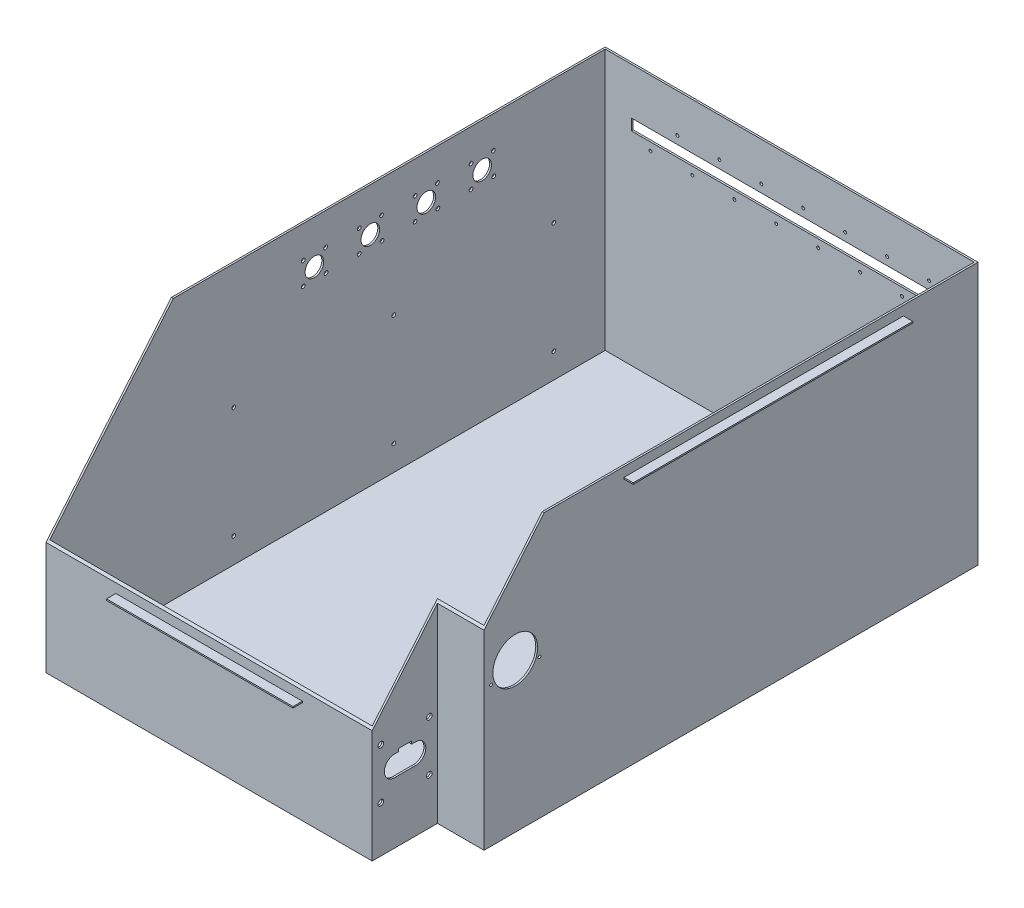
from build123d import *

# Parameters (mm, degrees)
BOSS_EXTRUDE1_DEPTH     = 1.5
BOSS_EXTRUDE2_DEPTH     = 280
SKETCH4_W               = 400
SKETCH4_H               = 42.385541564
BOSS_EXTRUDE3_DEPTH     = 2
CUT_EXTRUDE1_DEPTH      = 609.61485268
CUT_EXTRUDE1_DEPTH_BACK = 609.61485268
SKETCH10_R              = 3
CUT_EXTRUDE2_DEPTH      = 2
SKETCH5_R               = 2
SKETCH5_R_2             = 10
CUT_EXTRUDE7_DEPTH      = 2
SKETCH21_W              = 300
SKETCH21_H              = 1.5
BOSS_EXTRUDE9_DEPTH     = 10
SKETCH22_W              = 300
SKETCH22_H              = 1.5
BOSS_EXTRUDE10_DEPTH    = 10
BOSS_EXTRUDE11_DEPTH    = 0.75
BOSS_EXTRUDE12_DEPTH    = 0.75
BOSS_EXTRUDE13_DEPTH    = 0.75
BOSS_EXTRUDE14_DEPTH    = 0.75
SKETCH27_W              = 200
SKETCH27_H              = 1.5
BOSS_EXTRUDE15_DEPTH    = 10
BOSS_EXTRUDE16_DEPTH    = 0.75
BOSS_EXTRUDE17_DEPTH    = 0.75
SKETCH30_R              = 24
SKETCH30_R_2            = 1.5
CUT_EXTRUDE8_DEPTH      = 2
SKETCH33_R              = 2
CUT_EXTRUDE9_DEPTH      = 2
SKETCH42_W              = 340
SKETCH42_H              = 12
SKETCH42_R              = 1.6
CUT_EXTRUDE13_DEPTH     = 40


with BuildPart() as part:
    # Sketch1 → Boss-Extrude1 (new body)
    with BuildSketch(Plane(origin=(0, 0, 0), x_dir=(1, 0, 0), z_dir=(0, 1, 0))):
        Polygon((-200, 237.826300096), (200, 237.826300096), (200, -292.173699904), (150, -292.173699904), (150, -362.173699904), (-200, -362.173699904), align=None)
    extrude(amount=BOSS_EXTRUDE1_DEPTH)

    # Sketch2 → Boss-Extrude2 (add)
    with BuildSketch(Plane(origin=(0, 1.5, 0), x_dir=(1, 0, 0), z_dir=(0, 1, 0))):
        Polygon((-200, 237.826300096), (-200, -362.173699904), (150, -362.173699904), (150, -292.173699904), (200, -292.173699904), (200, 237.826300096), align=None)
        Polygon((-198, 235.826300096), (-198, -360.173699904), (148, -360.173699904), (148, -290.173699904), (198, -290.173699904), (198, 235.826300096), align=None, mode=Mode.SUBTRACT)
    extrude(amount=BOSS_EXTRUDE2_DEPTH)

    # Sketch4 → Boss-Extrude3 (add)
    with BuildSketch(Plane(origin=(0, 0, -237.826300096), x_dir=(-1, 0, 0), z_dir=(0, 0, -1))):
        with Locations((0, 213.483316708)):
            Rectangle(SKETCH4_W, SKETCH4_H)
    extrude(amount=-BOSS_EXTRUDE3_DEPTH)

    # Sketch3 → Cut-Extrude1 (cut, two sides: drawn at the far end of the back side and taken through both)
    with BuildSketch(Plane.ZY.offset(200).offset(-CUT_EXTRUDE1_DEPTH_BACK)):
        Polygon((362.173699904, 121.117558148), (227.596852099, 281.5), (362.173699904, 281.5), align=None)
    extrude(amount=CUT_EXTRUDE1_DEPTH + CUT_EXTRUDE1_DEPTH_BACK, mode=Mode.SUBTRACT)

    # Sketch10 → Cut-Extrude2 (cut)
    with BuildSketch(Plane.ZY.offset(-148)):
        with BuildLine():
            Line((333.923699904, 90.5), (319.923699904, 90.5))
            Line((319.923699904, 90.5), (319.923699904, 87.5))
            Line((319.923699904, 87.5), (315.673699904, 87.5))
            ThreePointArc((315.673699904, 87.5), (304.673699904, 76.5), (315.673699904, 65.5))
            Line((315.673699904, 65.5), (338.173699904, 65.5))
            ThreePointArc((338.173699904, 65.5), (349.173699904, 76.5), (338.173699904, 87.5))
            Line((338.173699904, 87.5), (333.923699904, 87.5))
            Line((333.923699904, 87.5), (333.923699904, 90.5))
        make_face()
        with Locations((300.973699904, 103.45)):
            Circle(SKETCH10_R)
        with Locations((352.873699904, 103.45)):
            Circle(SKETCH10_R)
        with Locations((300.973699904, 49.55)):
            Circle(SKETCH10_R)
        with Locations((352.873699904, 49.55)):
            Circle(SKETCH10_R)
    extrude(amount=-CUT_EXTRUDE2_DEPTH, mode=Mode.SUBTRACT)

    # Sketch5 → Cut-Extrude7 (cut)
    with BuildSketch(Plane.ZY.offset(200)):
        with Locations((-115.826300096, 247.120648807)):
            Circle(SKETCH5_R)
        with Locations((-116.326300096, 223.125857706)):
            Circle(SKETCH5_R)
        with Locations((-91.826300096, 223.120648807)):
            Circle(SKETCH5_R)
        with Locations((-91.826300096, 247.120648807)):
            Circle(SKETCH5_R)
        with Locations((-103.826300096, 235.120648807)):
            Circle(SKETCH5_R_2)
        with Locations((-55.826300096, 247.120648807)):
            Circle(SKETCH5_R)
        with Locations((-56.326300096, 223.125857706)):
            Circle(SKETCH5_R)
        with Locations((-31.826300096, 223.120648807)):
            Circle(SKETCH5_R)
        with Locations((-31.826300096, 247.120648807)):
            Circle(SKETCH5_R)
        with Locations((-43.826300096, 235.120648807)):
            Circle(SKETCH5_R_2)
        with Locations((4.173699904, 247.120648807)):
            Circle(SKETCH5_R)
        with Locations((3.673699904, 223.125857706)):
            Circle(SKETCH5_R)
        with Locations((28.173699904, 223.120648807)):
            Circle(SKETCH5_R)
        with Locations((28.173699904, 247.120648807)):
            Circle(SKETCH5_R)
        with Locations((16.173699904, 235.120648807)):
            Circle(SKETCH5_R_2)
        with Locations((64.173699904, 247.120648807)):
            Circle(SKETCH5_R)
        with Locations((63.673699904, 223.125857706)):
            Circle(SKETCH5_R)
        with Locations((88.173699904, 223.120648807)):
            Circle(SKETCH5_R)
        with Locations((88.173699904, 247.120648807)):
            Circle(SKETCH5_R)
        with Locations((76.173699904, 235.120648807)):
            Circle(SKETCH5_R_2)
    extrude(amount=-CUT_EXTRUDE7_DEPTH, mode=Mode.SUBTRACT)

    # Sketch21 → Boss-Extrude9 (add)
    with BuildSketch(Plane(origin=(0, 0, -237.826300096), x_dir=(-1, 0, 0), z_dir=(0, 0, -1))):
        with Locations((0, 270.75)):
            Rectangle(SKETCH21_W, SKETCH21_H)
    extrude(amount=BOSS_EXTRUDE9_DEPTH)

    # Sketch22 → Boss-Extrude10 (add)
    with BuildSketch(Plane.ZY.offset(200)):
        with Locations((-7.826300096, 270.75)):
            Rectangle(SKETCH22_W, SKETCH22_H)
    boss_extrude10 = extrude(amount=BOSS_EXTRUDE10_DEPTH)

    # Sketch23 → Boss-Extrude11 (add, symmetric)
    with BuildSketch(Plane(origin=(0, 0, -77.826300096), x_dir=(-1, 0, 0), z_dir=(0, 0, -1))):
        Polygon((210, 270), (200, 270), (200, 260), align=None)
    boss_extrude11 = extrude(amount=BOSS_EXTRUDE11_DEPTH, both=True)

    # Sketch24 → Boss-Extrude12 (add, symmetric)
    with BuildSketch(Plane.XY.offset(52.173699904)):
        Polygon((-210, 270), (-200, 260), (-200, 270), align=None)
    boss_extrude12 = extrude(amount=BOSS_EXTRUDE12_DEPTH, both=True)

    # Sketch25 → Boss-Extrude13 (add, symmetric)
    with BuildSketch(Plane(origin=(100, 0, 0), x_dir=(0, 0, -1), z_dir=(1, 0, 0))):
        Polygon((247.826300096, 270), (237.826300096, 270), (237.826300096, 260), align=None)
    extrude(amount=BOSS_EXTRUDE13_DEPTH, both=True)

    # Sketch26 → Boss-Extrude14 (add, symmetric)
    with BuildSketch(Plane.ZY.offset(100)):
        Polygon((-247.826300096, 270), (-237.826300096, 260), (-237.826300096, 270), align=None)
    extrude(amount=BOSS_EXTRUDE14_DEPTH, both=True)

    # Mirror1: Boss-Extrude10, Boss-Extrude11, Boss-Extrude12 across plane
    add(boss_extrude10.mirror(Plane(origin=(0, 0, 0), x_dir=(0, 0, 1), z_dir=(1, 0, 0))))
    add(boss_extrude11.mirror(Plane(origin=(0, 0, 0), x_dir=(0, 0, 1), z_dir=(1, 0, 0))))
    add(boss_extrude12.mirror(Plane(origin=(0, 0, 0), x_dir=(0, 0, 1), z_dir=(1, 0, 0))))

    # Sketch27 → Boss-Extrude15 (add)
    with BuildSketch(Plane.XY.offset(362.173699904)):
        with Locations((-25, 110.367558148)):
            Rectangle(SKETCH27_W, SKETCH27_H)
    extrude(amount=BOSS_EXTRUDE15_DEPTH)

    # Sketch28 → Boss-Extrude16 (add, symmetric)
    with BuildSketch(Plane.ZY.offset(95)):
        Polygon((372.173699904, 109.617558148), (362.173699904, 109.617558148), (362.173699904, 99.617558148), align=None)
    extrude(amount=BOSS_EXTRUDE16_DEPTH, both=True)

    # Sketch29 → Boss-Extrude17 (add, symmetric)
    with BuildSketch(Plane(origin=(45, 0, 0), x_dir=(0, 0, -1), z_dir=(1, 0, 0))):
        Polygon((-372.173699904, 109.617558148), (-362.173699904, 99.617558148), (-362.173699904, 109.617558148), align=None)
    extrude(amount=BOSS_EXTRUDE17_DEPTH, both=True)

    # Sketch30 → Cut-Extrude8 (cut)
    with BuildSketch(Plane(origin=(200, 0, 0), x_dir=(0, 0, -1), z_dir=(1, 0, 0))):
        with Locations((-258.673699904, 160)):
            Circle(SKETCH30_R)
        with Locations((-284.673699904, 150)):
            Circle(SKETCH30_R_2)
        with Locations((-232.673699904, 150)):
            Circle(SKETCH30_R_2)
    extrude(amount=-CUT_EXTRUDE8_DEPTH, mode=Mode.SUBTRACT)

    # Sketch33 → Cut-Extrude9 (cut)
    with BuildSketch(Plane.ZY.offset(200)):
        with Locations((-180.626300096, 147.77)):
            Circle(SKETCH33_R)
        with Locations((-180.626300096, 28.39)):
            Circle(SKETCH33_R)
        with Locations((-8.926300096, 147.77)):
            Circle(SKETCH33_R)
        with Locations((-8.926300096, 28.39)):
            Circle(SKETCH33_R)
        with Locations((162.773699904, 147.77)):
            Circle(SKETCH33_R)
        with Locations((162.773699904, 28.39)):
            Circle(SKETCH33_R)
    extrude(amount=-CUT_EXTRUDE9_DEPTH, mode=Mode.SUBTRACT)

    # Sketch42 → Cut-Extrude13 (cut)
    with BuildSketch(Plane.XY.offset(-235.826300096)):
        with Locations((0, 225.5)):
            Rectangle(SKETCH42_W, SKETCH42_H)
        with Locations((-120.5, 240)):
            Circle(SKETCH42_R)
        with Locations((-149.5, 211)):
            Circle(SKETCH42_R)
        with Locations((-75.5, 240)):
            Circle(SKETCH42_R)
        with Locations((-104.5, 211)):
            Circle(SKETCH42_R)
        with Locations((-30.5, 240)):
            Circle(SKETCH42_R)
        with Locations((-59.5, 211)):
            Circle(SKETCH42_R)
        with Locations((14.5, 240)):
            Circle(SKETCH42_R)
        with Locations((-14.5, 211)):
            Circle(SKETCH42_R)
        with Locations((59.5, 240)):
            Circle(SKETCH42_R)
        with Locations((30.5, 211)):
            Circle(SKETCH42_R)
        with Locations((104.5, 240)):
            Circle(SKETCH42_R)
        with Locations((75.5, 211)):
            Circle(SKETCH42_R)
        with Locations((149.5, 240)):
            Circle(SKETCH42_R)
        with Locations((120.5, 211)):
            Circle(SKETCH42_R)
    extrude(amount=-CUT_EXTRUDE13_DEPTH, mode=Mode.SUBTRACT)


solid = part.part
